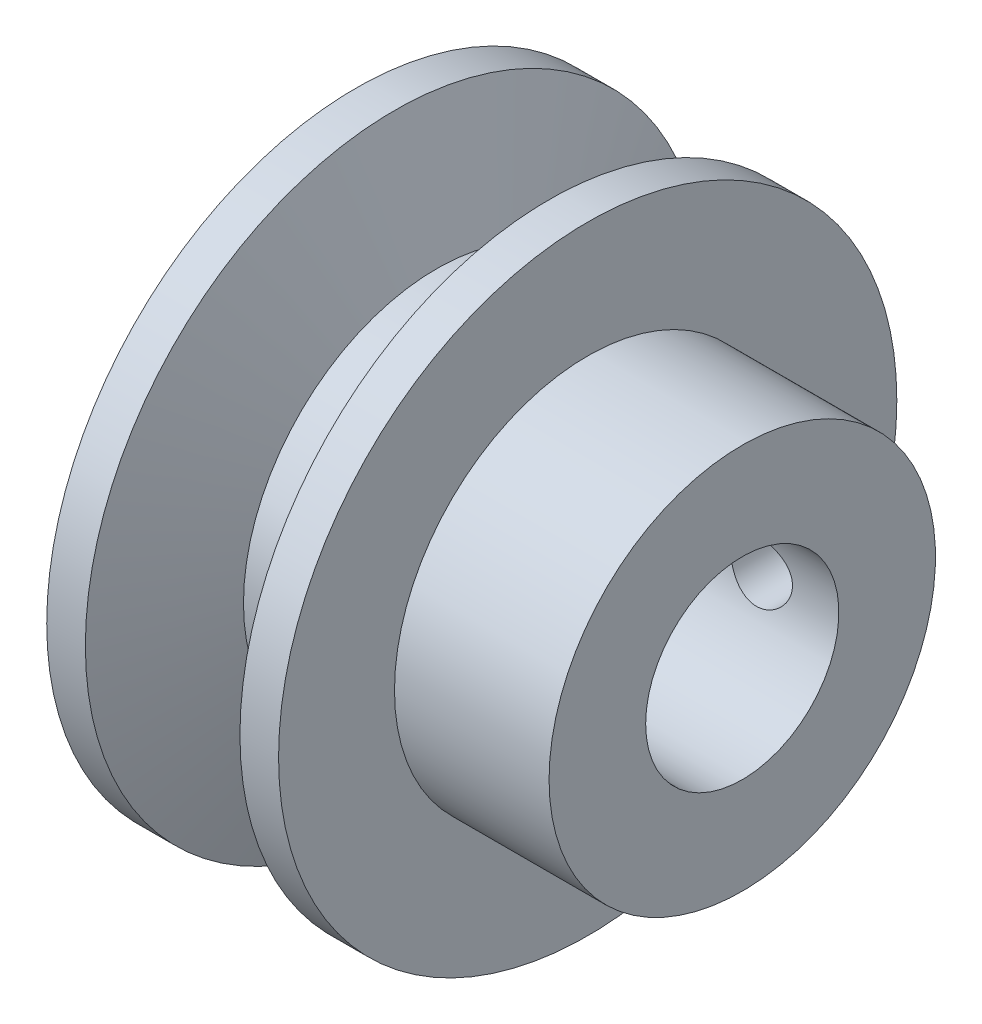
from build123d import *

# Parameters (mm, degrees)
SKETCH1_W          = 6
SKETCH1_H          = 12.5
SKETCH1_W_2        = 8
SKETCH7_W          = 10
SKETCH7_H          = 12.5
CUT_EXTRUDE1_REACH = 95.493
SKETCH8_R          = 4
CUT_EXTRUDE2_REACH = 87.277
CUT_EXTRUDE3_DEPTH = 20


with BuildPart() as part:
    # Sketch1 → Revolve1 (revolve)
    with BuildSketch(Plane(origin=(0, 0, 0), x_dir=(1, 0, 0), z_dir=(0, 1, 0)), mode=Mode.PRIVATE) as revolve1_sk:
        Polygon((5, 12.5), (0, 20), (0, 40), (5, 40), (10.459553514, 25), (19.540446486, 25), (25, 40), (30, 40), (30, 25), (36, 25), (36, 12.5), align=None)
        with Locations((47, 18.75)):
            Rectangle(SKETCH1_W, SKETCH1_H)
        with Locations((40, 18.75)):
            Rectangle(SKETCH1_W_2, SKETCH1_H)
    revolve(revolve1_sk.sketch.rotate(Axis((-23.221484356, 0, 0), (1, 0, 0)), 180), axis=Axis((-23.221484356, 0, 0), (1, 0, 0)))

    # Sketch7 → Revolve-Thin2 (revolve)
    with BuildSketch(Plane(origin=(0, 0, 0), x_dir=(1, 0, 0), z_dir=(0, 1, 0))):
        with Locations((31, 18.75)):
            Rectangle(SKETCH7_W, SKETCH7_H)
    revolve(axis=Axis((40, 0, -25), (0, 0, 1)))

    # Sketch8 → Cut-Extrude1 (cut, up to next)
    with BuildSketch(Plane(origin=(0, 0, -25), x_dir=(-1, 0, 0), z_dir=(0, 0, -1)), mode=Mode.PRIVATE) as cut_extrude1_sk1:
        with Locations((-40, 0)):
            Circle(SKETCH8_R)
    cut_extrude1_tool1 = extrude(cut_extrude1_sk1.sketch, amount=-CUT_EXTRUDE1_REACH, mode=Mode.PRIVATE) & part.part
    add(cut_extrude1_tool1.solids().sort_by_distance((40, 0, -25))[0], mode=Mode.SUBTRACT)

    # Sketch9 → Cut-Extrude2 (cut, up to next)
    with BuildSketch(Plane.XY.offset(-12.5), mode=Mode.PRIVATE) as cut_extrude2_sk1:
        with BuildLine():
            Line((50, 9.797958971), (50, -9.797958971))
            ThreePointArc((50, -9.797958971), (54, 0), (50, 9.797958971))
        make_face()
    cut_extrude2_tool1 = extrude(cut_extrude2_sk1.sketch, amount=-CUT_EXTRUDE2_REACH, mode=Mode.PRIVATE) & part.part
    add(cut_extrude2_tool1.solids().sort_by_distance((51.621368, 0, -12.5))[0], mode=Mode.SUBTRACT)

    # Sketch12 → Cut-Extrude3 (cut)
    with BuildSketch(Plane(origin=(50, 0, 0), x_dir=(0, 0, -1), z_dir=(1, 0, 0))):
        with BuildLine():
            Line((25, 9.797958971), (25, 14))
            Line((25, 14), (20.712315177, 14))
            ThreePointArc((20.712315177, 14), (21.956910341, 11.953831531), (23, 9.797958971))
            Line((23, 9.797958971), (25, 9.797958971))
        make_face()
        with BuildLine():
            Line((25, 0), (25, 9.797958971))
            Line((25, 9.797958971), (23, 9.797958971))
            ThreePointArc((23, 9.797958971), (24.494897428, 5), (25, 0))
        make_face()
        with BuildLine():
            ThreePointArc((23, -9.797958971), (21.956910341, -11.953831531), (20.712315177, -14))
            Line((20.712315177, -14), (25, -14))
            Line((25, -14), (25, -9.797958971))
            Line((25, -9.797958971), (23, -9.797958971))
        make_face()
        with BuildLine():
            Line((25, -9.797958971), (25, 0))
            ThreePointArc((25, 0), (24.494897428, -5), (23, -9.797958971))
            Line((23, -9.797958971), (25, -9.797958971))
        make_face()
    extrude(amount=-CUT_EXTRUDE3_DEPTH, mode=Mode.SUBTRACT)


solid = part.part
